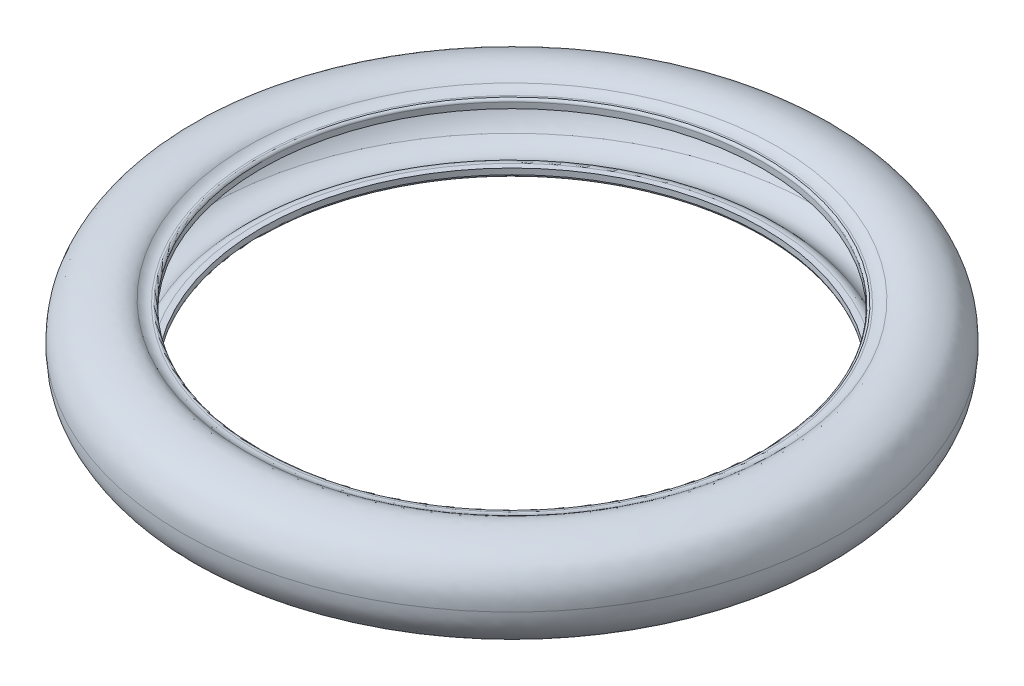
from build123d import *


with BuildPart() as part:
    # Sketch3 → Revolve1 (revolve)
    with BuildSketch(Plane.XY, mode=Mode.PRIVATE) as revolve1_sk:
        with BuildLine():
            Line((82.231190476, 71.5640625), (80.731190476, 71.5640625))
            ThreePointArc((80.731190476, 71.5640625), (79.316976914, 70.978276062), (78.731190476, 69.5640625))
            Line((78.731190476, 69.5640625), (78.731190476, 64.8640625))
            Line((78.731190476, 64.8640625), (83.40490957, 64.8640625))
            ThreePointArc((83.40490957, 64.8640625), (87.635971897, 65.803261675), (91.072272174, 68.444440183))
            ThreePointArc((91.072272174, 68.444440183), (105.959074636, 76.173037615), (121.928289933, 71.041539914))
            ThreePointArc((121.928289933, 71.041539914), (127.538702606, 63.399757925), (130.992222147, 54.571011405))
            ThreePointArc((130.992222147, 54.571011405), (131.639460488, 49.335402016), (131.848033891, 44.0640625))
            ThreePointArc((131.848033891, 44.0640625), (131.639460488, 38.792722984), (130.992222147, 33.557113595))
            ThreePointArc((130.992222147, 33.557113595), (127.538702606, 24.728367075), (121.928289933, 17.086585086))
            ThreePointArc((121.928289933, 17.086585086), (105.959074636, 11.955087385), (91.072272174, 19.683684817))
            ThreePointArc((91.072272174, 19.683684817), (87.635971897, 22.324863325), (83.40490957, 23.2640625))
            Line((83.40490957, 23.2640625), (78.731190476, 23.2640625))
            Line((78.731190476, 23.2640625), (78.731190476, 18.5640625))
            ThreePointArc((78.731190476, 18.5640625), (79.316976914, 17.149848938), (80.731190476, 16.5640625))
            Line((80.731190476, 16.5640625), (82.231190476, 16.5640625))
            ThreePointArc((82.231190476, 16.5640625), (86.604591271, 15.774031137), (90.425172259, 13.503800978))
            add(Edge.make_bspline(
                [(90.425172259, 13.503800978), (93.453485577, 10.875132375), (104.099152613, 8.153977192), (115.420380538, 10.151200404), (124.532463534, 12.98180807), (131.71404351, 16.228513371), (137.277996399, 23.664562052), (139.548984913, 27.49462131), (142.234474417, 34.640956758), (142.631190476, 39.679489098), (142.631190476, 44.0640625)],
                knots=[0, 0, 0, 0, 0.186434326, 0.396887819, 0.443716841, 0.631279243, 0.67359989, 0.824602664, 0.85913021, 1, 1, 1, 1], degree=3))
            add(Edge.make_bspline(
                [(90.425172259, 74.624324022), (93.453485577, 77.252992625), (104.099152613, 79.974147808), (115.420380538, 77.976924596), (124.532463534, 75.14631693), (131.71404351, 71.899611629), (137.277996399, 64.463562948), (139.548984913, 60.63350369), (142.234474417, 53.487168242), (142.631190476, 48.448635902), (142.631190476, 44.0640625)],
                knots=[0, 0, 0, 0, 0.186434326, 0.396887819, 0.443716841, 0.631279243, 0.67359989, 0.824602664, 0.85913021, 1, 1, 1, 1], degree=3))
            ThreePointArc((90.425172259, 74.624324022), (86.604591271, 72.354093863), (82.231190476, 71.5640625))
        make_face()
    revolve(revolve1_sk.sketch.rotate(Axis((-124.068809524, 89.0640625, 0), (0, -1, 0)), 90), axis=Axis((-124.068809524, 89.0640625, 0), (0, -1, 0)))


solid = part.part
